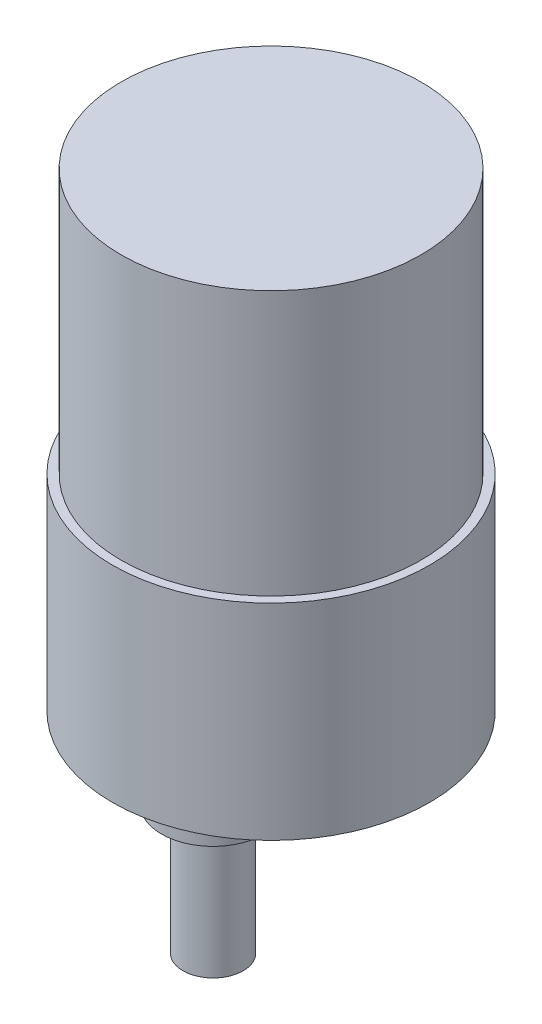
from build123d import *

# Parameters (mm, degrees)
CROQUIS1_R              = 18.4
SALIENTE_EXTRUIR1_DEPTH = 54.56
CROQUIS2_R              = 6
SALIENTE_EXTRUIR2_DEPTH = 6
CROQUIS3_R              = 3.5
SALIENTE_EXTRUIR3_DEPTH = 15
CORTAR_EXTRUIR1_START   = -15
CORTAR_EXTRUIR1_DEPTH   = 15
CROQUIS6_R              = 18.42847038
CORTAR_EXTRUIR2_DEPTH   = 30.7
CROQUIS7_R              = 17.4
SALIENTE_EXTRUIR5_DEPTH = 30.7


with BuildPart() as part:
    # Croquis1 → Saliente-Extruir1 (new body)
    with BuildSketch(Plane(origin=(0, 0, 0), x_dir=(1, 0, 0), z_dir=(0, 1, 0))):
        with Locations(Location((0, 0, 0), (0, 0, 270))):
            Circle(CROQUIS1_R)
    extrude(amount=-SALIENTE_EXTRUIR1_DEPTH)

    # Croquis2 → Saliente-Extruir2 (add)
    with BuildSketch(Plane.XZ.offset(54.56)):
        with Locations(Location((0, 6.73, 0), (0, 0, 90))):
            Circle(CROQUIS2_R)
    extrude(amount=SALIENTE_EXTRUIR2_DEPTH)

    # Croquis3 → Saliente-Extruir3 (add)
    with BuildSketch(Plane.XZ.offset(60.56)):
        with Locations(Location((0, 6.73, 0), (0, 0, 270))):
            Circle(CROQUIS3_R)
    extrude(amount=SALIENTE_EXTRUIR3_DEPTH)

    # Croquis4 → Cortar-Extruir1 (cut)
    with BuildSketch(Plane(origin=(0, -75.56, 0), x_dir=(-1, 0, 0), z_dir=(0, -1, 0)).offset(CORTAR_EXTRUIR1_START)):
        with BuildLine():
            Line((2.449489743, -4.23), (-2.449489743, -4.23))
            ThreePointArc((-2.449489743, -4.23), (0, -3.23), (2.449489743, -4.23))
        make_face()
    extrude(amount=CORTAR_EXTRUIR1_DEPTH, mode=Mode.SUBTRACT)

    # Croquis6 → Cortar-Extruir2 (cut)
    with BuildSketch(Plane(origin=(0, 0, 0), x_dir=(1, 0, 0), z_dir=(0, 1, 0))):
        Circle(CROQUIS6_R)
    extrude(amount=-CORTAR_EXTRUIR2_DEPTH, mode=Mode.SUBTRACT)

    # Croquis7 → Saliente-Extruir5 (add)
    with BuildSketch(Plane(origin=(0, -30.7, 0), x_dir=(1, 0, 0), z_dir=(0, 1, 0))):
        with Locations(Location((0, 0, 0), (0, 0, 270))):
            Circle(CROQUIS7_R)
    extrude(amount=SALIENTE_EXTRUIR5_DEPTH)


solid = part.part
